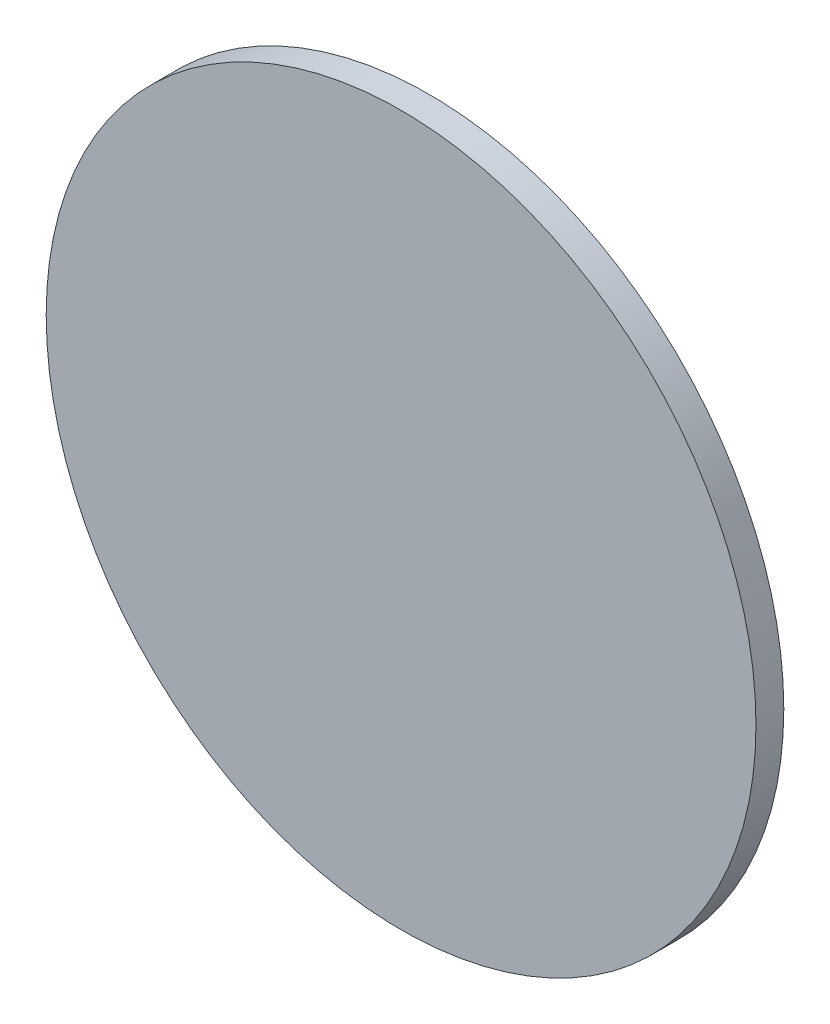
from build123d import *

# Parameters (mm, degrees)
SKETCH_2_R      = 127.5
EXTRUDE_1_DEPTH = 10


with BuildPart() as part:
    # ｽｹｯﾁ2 → ﾎﾞｽ - 押し出し1 (new body)
    with BuildSketch(Plane.XY):
        Circle(SKETCH_2_R)
    extrude(amount=EXTRUDE_1_DEPTH)


solid = part.part
